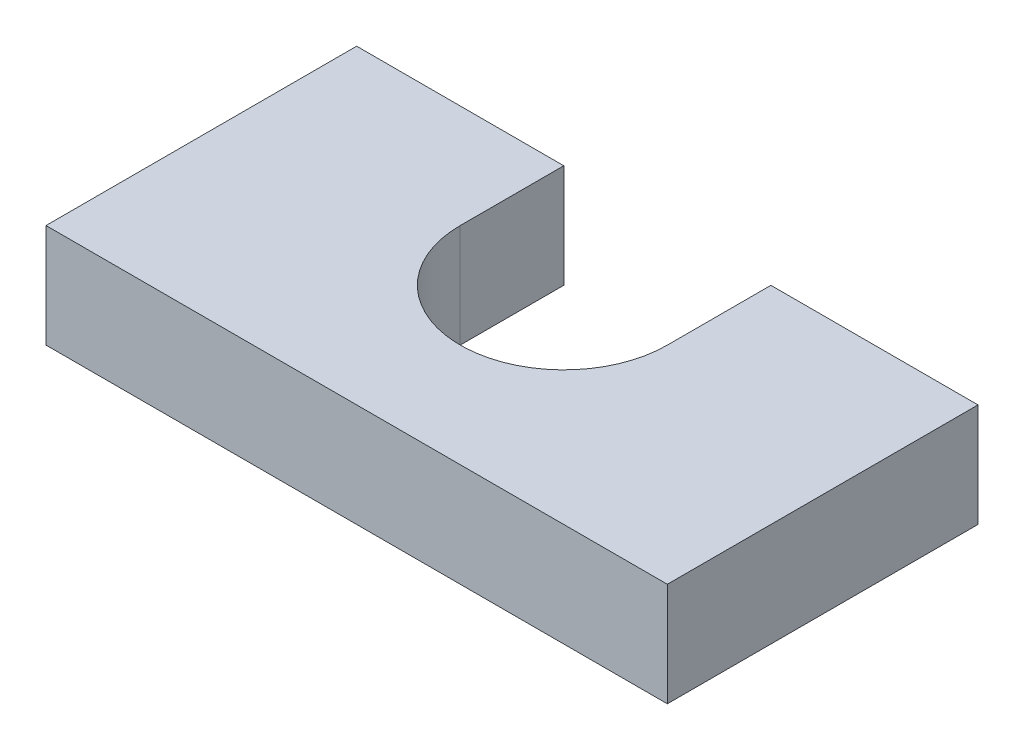
from build123d import *

# Parameters (mm, degrees)
BOSS_EXTRUDE1_DEPTH = 20


with BuildPart() as part:
    # Sketch2 → Boss-Extrude1 (new body)
    with BuildSketch(Plane(origin=(0, 0, 0), x_dir=(1, 0, 0), z_dir=(0, 1, 0))):
        with BuildLine():
            Line((-20, 0), (-20, -20))
            ThreePointArc((-20, -20), (0, -40), (20, -20))
            Line((20, -20), (20, 0))
            Line((20, 0), (60, 0))
            Line((60, 0), (60, -60))
            Line((60, -60), (-60, -60))
            Line((-60, -60), (-60, 0))
            Line((-60, 0), (-20, 0))
        make_face()
    extrude(amount=BOSS_EXTRUDE1_DEPTH)


solid = part.part
